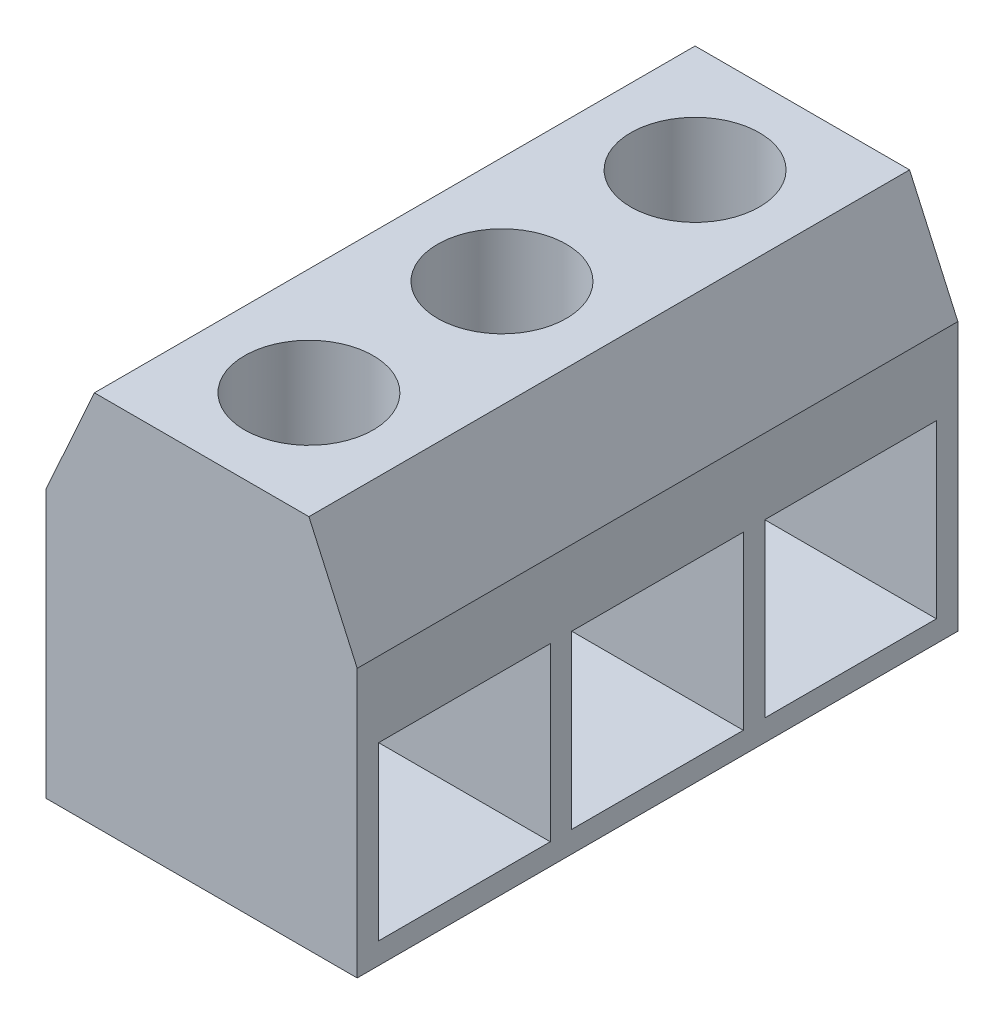
from build123d import *

# Parameters (mm, degrees)
EXTRUDE_1_DEPTH     = 14.224
SKETCH_2_R          = 1.524
CUT_EXTRUDE_1_DEPTH = 8.382
SKETCH_3_W          = 4.064
SKETCH_3_H          = 4.064
CUT_EXTRUDE_2_DEPTH = 5.334
SKETCH_4_W          = 0.762
SKETCH_4_H          = 6.35
CUT_EXTRUDE_3_DEPTH = 1.27


with BuildPart() as part:
    # 草图1 → 凸台-拉伸1 (new body)
    with BuildSketch(Plane.XY):
        Polygon((0, 0), (7.366, 0), (7.366, 6.35), (6.223, 8.89), (1.143, 8.89), (0, 6.35), align=None)
    extrude(amount=EXTRUDE_1_DEPTH)

    # 草图2 → 切除-拉伸1 (cut)
    with BuildSketch(Plane(origin=(0, 8.89, 0), x_dir=(1, 0, 0), z_dir=(0, 1, 0))):
        with Locations(Location((3.683, -2.54, 0), (0, 0, 270))):
            Circle(SKETCH_2_R)
        with Locations(Location((3.683, -11.684, 0), (0, 0, 270))):
            Circle(SKETCH_2_R)
        with Locations(Location((3.683, -7.112, 0), (0, 0, 270))):
            Circle(SKETCH_2_R)
    extrude(amount=-CUT_EXTRUDE_1_DEPTH, mode=Mode.SUBTRACT)

    # 草图3 → 切除-拉伸2 (cut)
    with BuildSketch(Plane(origin=(7.366, 0, 0), x_dir=(0, 0, -1), z_dir=(1, 0, 0))):
        with Locations((-11.684, 2.54)):
            Rectangle(SKETCH_3_W, SKETCH_3_H)
        Polygon((-7.112, 0.508), (-9.144, 0.508), (-9.144, 4.572), (-5.08, 4.572), (-5.08, 0.508), align=None)
        with Locations((-2.54, 2.54)):
            Rectangle(SKETCH_3_W, SKETCH_3_H)
    extrude(amount=-CUT_EXTRUDE_2_DEPTH, mode=Mode.SUBTRACT)

    # 草图4 → 切除-拉伸3 (cut)
    with BuildSketch(Plane.XY):
        with Locations((1.397, 3.175)):
            Rectangle(SKETCH_4_W, SKETCH_4_H)
    extrude(amount=CUT_EXTRUDE_3_DEPTH, mode=Mode.SUBTRACT)


solid = part.part
